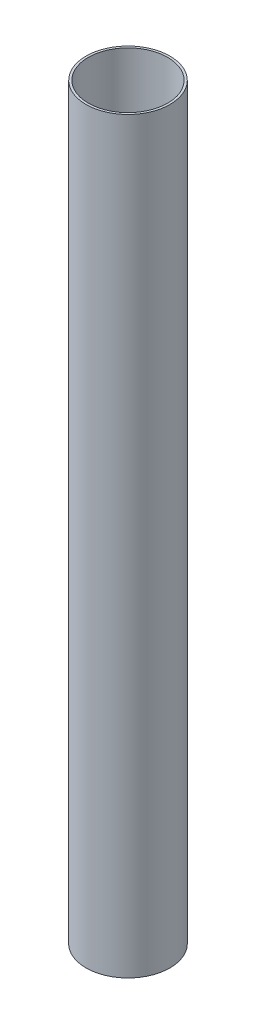
from build123d import *

# Parameters (mm, degrees)
SKETCH1_W = 1.524
SKETCH1_H = 508


with BuildPart() as part:
    # Sketch1 → Revolve1 (revolve)
    with BuildSketch(Plane.XY, mode=Mode.PRIVATE) as revolve1_sk:
        with Locations((27.7368, 254)):
            Rectangle(SKETCH1_W, SKETCH1_H)
    revolve(revolve1_sk.sketch.rotate(Axis((0, 123.620053705, 0), (0, -1, 0)), 90), axis=Axis((0, 123.620053705, 0), (0, -1, 0)))


solid = part.part
